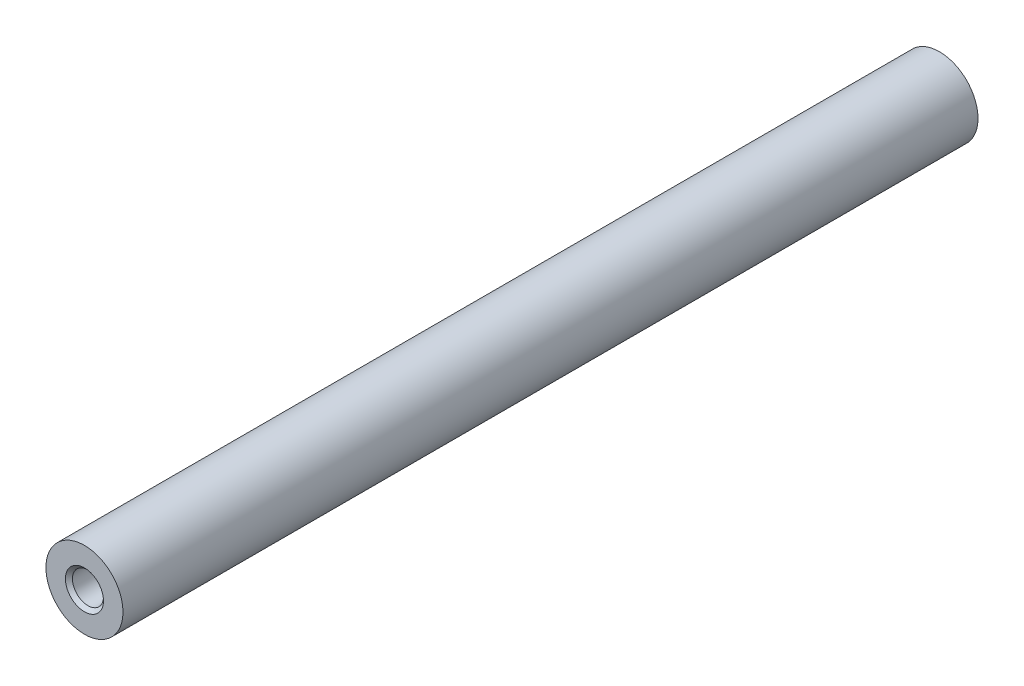
from build123d import *

# Parameters (mm, degrees)
ESBO_O1_R                           = 4.1
RESSALTO_EXTRUS_O1_DEPTH            = 91
FURO_ROSCADO_DE_M4X0_71_D           = 3.3
FURO_ROSCADO_DE_M4X0_71_DEPTH       = 11.5
FURO_ROSCADO_DE_M4X0_71_CSINK_D     = 4.05
FURO_ROSCADO_DE_M4X0_71_CSINK_ANGLE = 90
FURO_ROSCADO_DE_M4X0_71_TIP         = 0.991420021
FURO_ROSCADO_DE_M4X0_72_D           = 3.3
FURO_ROSCADO_DE_M4X0_72_DEPTH       = 11.5
FURO_ROSCADO_DE_M4X0_72_CSINK_D     = 4.05
FURO_ROSCADO_DE_M4X0_72_CSINK_ANGLE = 90
FURO_ROSCADO_DE_M4X0_72_TIP         = 0.991420021


with BuildPart() as part:
    # Esboço1 → Ressalto-extrusão1 (new body)
    with BuildSketch(Plane.XY):
        with Locations((-29.071712183, 179.873872767)):
            Circle(ESBO_O1_R)
    extrude(amount=-RESSALTO_EXTRUS_O1_DEPTH)

    # Furo roscado de M4x0.71
    with Locations(Plane.XY):
        with Locations((-29.071712183, 179.873872767)):
            CounterSinkHole(FURO_ROSCADO_DE_M4X0_71_D / 2, FURO_ROSCADO_DE_M4X0_71_CSINK_D / 2, depth=FURO_ROSCADO_DE_M4X0_71_DEPTH, counter_sink_angle=FURO_ROSCADO_DE_M4X0_71_CSINK_ANGLE)
            with Locations((0, 0, -(FURO_ROSCADO_DE_M4X0_71_DEPTH + FURO_ROSCADO_DE_M4X0_71_TIP / 2))):  # 118° drill point
                Cone(0, FURO_ROSCADO_DE_M4X0_71_D / 2, FURO_ROSCADO_DE_M4X0_71_TIP, mode=Mode.SUBTRACT)

    # Furo roscado de M4x0.72
    with Locations(Plane(origin=(0, 0, -91), x_dir=(-1, 0, 0), z_dir=(0, 0, -1))):
        with Locations((29.071712183, 179.873872767)):
            CounterSinkHole(FURO_ROSCADO_DE_M4X0_72_D / 2, FURO_ROSCADO_DE_M4X0_72_CSINK_D / 2, depth=FURO_ROSCADO_DE_M4X0_72_DEPTH, counter_sink_angle=FURO_ROSCADO_DE_M4X0_72_CSINK_ANGLE)
            with Locations((0, 0, -(FURO_ROSCADO_DE_M4X0_72_DEPTH + FURO_ROSCADO_DE_M4X0_72_TIP / 2))):  # 118° drill point
                Cone(0, FURO_ROSCADO_DE_M4X0_72_D / 2, FURO_ROSCADO_DE_M4X0_72_TIP, mode=Mode.SUBTRACT)


solid = part.part
